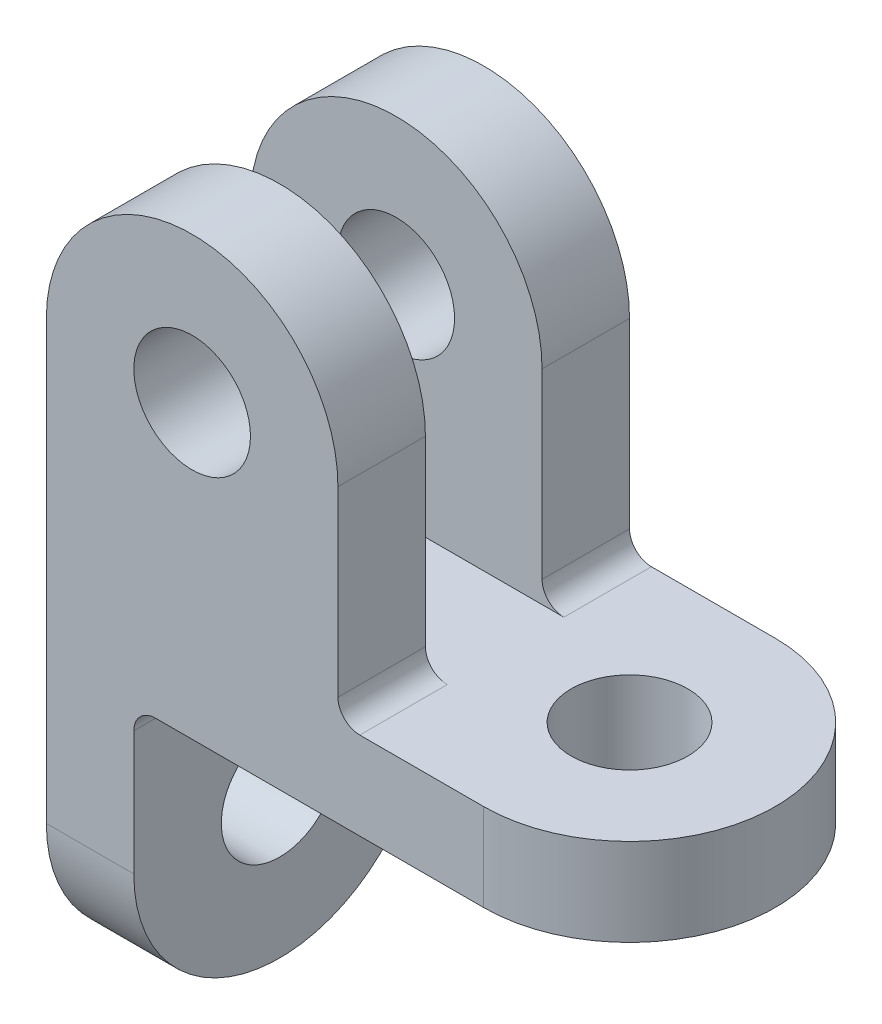
from build123d import *

# Parameters (mm, degrees)
BOSS_EXTRUDE1_DEPTH = 40
BOSS_EXTRUDE2_DEPTH = 12
SKETCH4_R           = 8
CUT_EXTRUDE1_DEPTH  = 12
BOSS_EXTRUDE3_DEPTH = 12
SKETCH6_R           = 8
CUT_EXTRUDE2_DEPTH  = 12
BOSS_EXTRUDE4_DEPTH = 40
SKETCH9_R           = 8
CUT_EXTRUDE3_DEPTH  = 40
SKETCH10_W          = 16
SKETCH10_H          = 52.648113389
CUT_EXTRUDE4_DEPTH  = 62
FILLET1_R           = 3


with BuildPart() as part:
    # Sketch1 → Boss-Extrude1 (new body)
    with BuildSketch(Plane.XY):
        Polygon((-46.523076923, -20), (-34.523076923, -20), (-34.523076923, 0), (13.476923077, 0), (13.476923077, 12), (-6.523076923, 12), (-6.523076923, 40), (-46.523076923, 40), align=None)
    extrude(amount=BOSS_EXTRUDE1_DEPTH)

    # Sketch3 → Boss-Extrude2 (add)
    with BuildSketch(Plane(origin=(-34.523076923, 0, 0), x_dir=(0, 0, -1), z_dir=(1, 0, 0))):
        with BuildLine():
            Line((-40, -20), (0, -20))
            ThreePointArc((0, -20), (-20, -40), (-40, -20))
        make_face()
    extrude(amount=-BOSS_EXTRUDE2_DEPTH)

    # Sketch4 → Cut-Extrude1 (cut)
    with BuildSketch(Plane(origin=(-34.523076923, 0, 0), x_dir=(0, 0, -1), z_dir=(1, 0, 0))):
        with Locations((-20, -20)):
            Circle(SKETCH4_R)
    extrude(amount=-CUT_EXTRUDE1_DEPTH, mode=Mode.SUBTRACT)

    # Sketch5 → Boss-Extrude3 (add)
    with BuildSketch(Plane(origin=(0, 12, 0), x_dir=(1, 0, 0), z_dir=(0, 1, 0))):
        with BuildLine():
            Line((13.476923077, 0), (13.476923077, -40))
            ThreePointArc((13.476923077, -40), (33.476923077, -20), (13.476923077, 0))
        make_face()
    extrude(amount=-BOSS_EXTRUDE3_DEPTH)

    # Sketch6 → Cut-Extrude2 (cut)
    with BuildSketch(Plane(origin=(0, 12, 0), x_dir=(1, 0, 0), z_dir=(0, 1, 0))):
        with Locations(Location((13.476923077, -20, 0), (0, 0, 180))):
            Circle(SKETCH6_R)
    extrude(amount=-CUT_EXTRUDE2_DEPTH, mode=Mode.SUBTRACT)

    # Sketch8 → Boss-Extrude4 (add)
    with BuildSketch(Plane.XY.offset(40)):
        with BuildLine():
            Line((-46.523076923, 40), (-6.523076923, 40))
            ThreePointArc((-6.523076923, 40), (-26.523076923, 60), (-46.523076923, 40))
        make_face()
    extrude(amount=-BOSS_EXTRUDE4_DEPTH)

    # Sketch9 → Cut-Extrude3 (cut)
    with BuildSketch(Plane.XY.offset(40)):
        with Locations((-26.523076923, 40)):
            Circle(SKETCH9_R)
    extrude(amount=-CUT_EXTRUDE3_DEPTH, mode=Mode.SUBTRACT)

    # Sketch10 → Cut-Extrude4 (cut)
    with BuildSketch(Plane(origin=(-6.523076923, 0, 0), x_dir=(0, 0, -1), z_dir=(1, 0, 0))):
        with Locations((-20, 38.324056695)):
            Rectangle(SKETCH10_W, SKETCH10_H)
    extrude(amount=-CUT_EXTRUDE4_DEPTH, mode=Mode.SUBTRACT)

    # Fillet1
    fillet1_edges = [part.edges().sort_by_distance(p)[0] for p in [
        (-6.523076923, 12, 34),
        (-34.523076923, 0, 20),
        (-6.523076923, 12, 6),
    ]]
    fillet(fillet1_edges, radius=FILLET1_R)


solid = part.part
